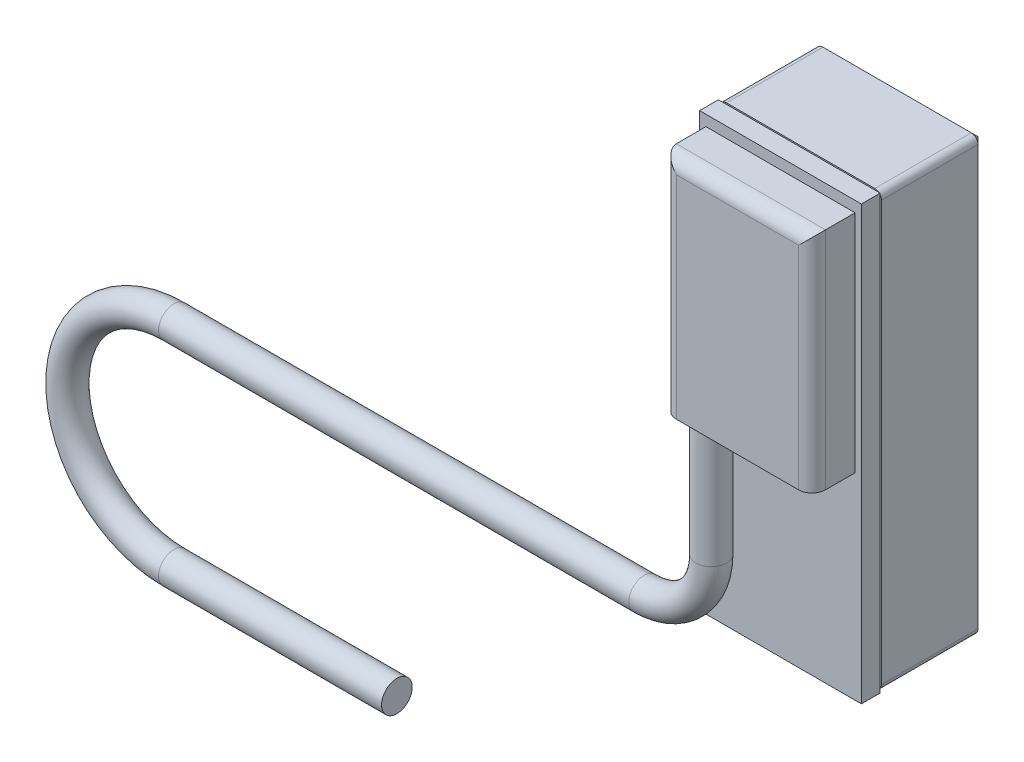
from build123d import *

# Parameters (mm, degrees)
SKETCH_1_W      = 6.02
SKETCH_1_H      = 16.11
EXTRUDE_1_DEPTH = 3.84
SKETCH_2_R      = 0.725
EXTRUDE_2_DEPTH = 0.2
SKETCH_3_W      = 6.02
SKETCH_3_H      = 16.11
EXTRUDE_3_DEPTH = 0.7
SKETCH_4_W      = 5.55
SKETCH_4_H      = 8.38
EXTRUDE_4_DEPTH = 1.6
FILLET_1_R      = 0.5
FILLET_2_R      = 0.25
CHAMFER_1_SIZE  = 0.25
SKETCH_5_R      = 0.57


with BuildPart() as part:
    # Эскиз1 → Бобышка-Вытянуть1 (new body)
    with BuildSketch(Plane.XY):
        Rectangle(SKETCH_1_W, SKETCH_1_H)
    extrude(amount=EXTRUDE_1_DEPTH)

    # Эскиз2 → Бобышка-Вытянуть2 (add)
    with BuildSketch(Plane(origin=(0, 0, 0), x_dir=(-1, 0, 0), z_dir=(0, 0, -1))):
        with Locations((-0.87, 0.795)):
            Circle(SKETCH_2_R)
    extrude(amount=EXTRUDE_2_DEPTH)

    # Скругление2
    fillet_2_edges = [part.edges().sort_by_distance(p)[0] for p in [
        (3.01, -8.055, 1.92),
        (-3.01, -8.055, 1.92),
        (-3.01, 8.055, 1.92),
        (3.01, 8.055, 1.92),
    ]]
    fillet(fillet_2_edges, radius=FILLET_2_R)

    # Фаска1
    chamfer_1_edges = [part.edges().sort_by_distance(p)[0] for p in [
        (0, -8.055, 0),
        (3.01, 0, 0),
        (-3.01, 0, 0),
        (0, 8.055, 0),
        (-2.936776695, 7.981776695, 0),
        (2.936776695, 7.981776695, 0),
        (2.936776695, -7.981776695, 0),
        (-2.936776695, -7.981776695, 0),
    ]]
    chamfer(chamfer_1_edges, length=CHAMFER_1_SIZE)


with BuildPart() as body_2:
    # Эскиз3 → Бобышка-Вытянуть3 (new body)
    with BuildSketch(Plane.XY.offset(3.89)):
        Rectangle(SKETCH_3_W, SKETCH_3_H)
    extrude(amount=EXTRUDE_3_DEPTH)

    # Эскиз4 → Бобышка-Вытянуть4 (add)
    with BuildSketch(Plane.XY.offset(4.59)):
        with Locations((0, 3.465)):
            Rectangle(SKETCH_4_W, SKETCH_4_H)
    extrude(amount=EXTRUDE_4_DEPTH)

    # Скругление1
    fillet_1_edges = [body_2.edges().sort_by_distance(p)[0] for p in [
        (2.775, 3.465, 6.19),
        (0, 7.655, 6.19),
        (-2.775, 3.465, 6.19),
    ]]
    fillet(fillet_1_edges, radius=FILLET_1_R)

    # По траектории1: sweep along a path in Эскиз6
    with BuildLine(Plane.XY.offset(5.39)) as sweep_1_path:
        Line((-1.775, -0.725), (-1.775, -5.225))
        ThreePointArc((-1.775, -5.225), (-2.507233047, -6.992766953), (-4.275, -7.725))
        Line((-4.275, -7.725), (-21.775, -7.725))
        ThreePointArc((-21.775, -7.725), (-25.735, -11.685), (-21.775, -15.645))
        Line((-21.775, -15.645), (-13.475, -15.645))
    # Эскиз5 → По траектории1 (sweep)
    with BuildSketch(Plane.XZ.offset(0.725)):
        with Locations((-1.775, 5.39)):
            Circle(SKETCH_5_R)
    sweep(path=sweep_1_path.line)


solid = Compound([part.part, body_2.part])
